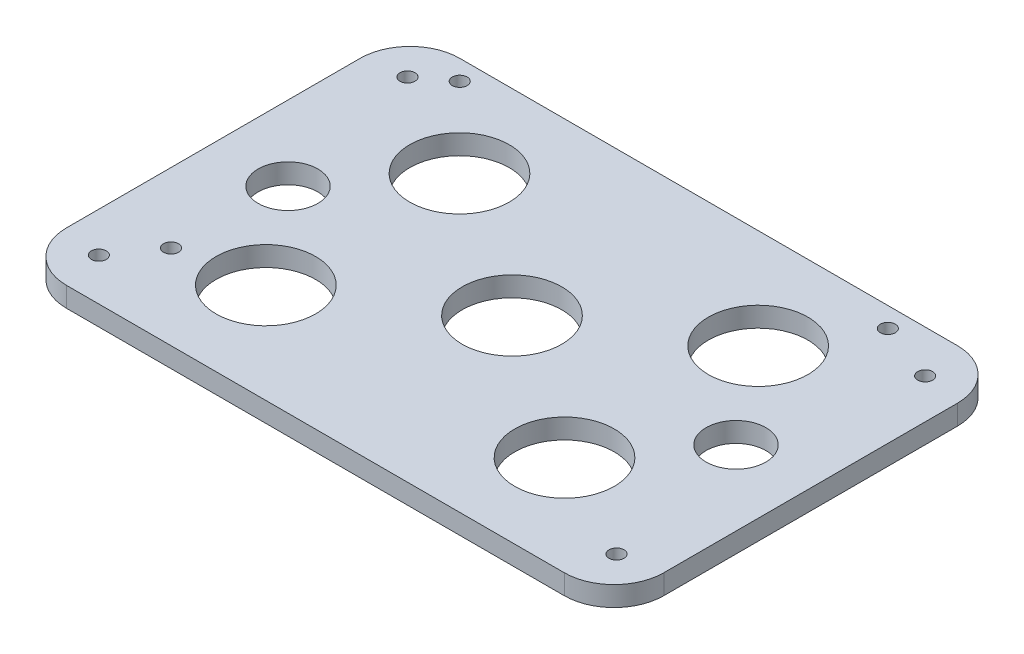
from build123d import *

# Parameters (mm, degrees)
SKETCH1_R           = 1.5
SKETCH1_R_2         = 6
SKETCH1_R_3         = 10
BOSS_EXTRUDE1_DEPTH = 4
CUT_EXTRUDE1_DEPTH  = 25


with BuildPart() as part:
    # Sketch1 → Boss-Extrude1 (new body)
    with BuildSketch(Plane(origin=(0, 0, 0), x_dir=(1, 0, 0), z_dir=(0, 1, 0))):
        with BuildLine():
            Line((-50, -39.5), (50, -39.5))
            ThreePointArc((50, -39.5), (57.071067812, -36.571067812), (60, -29.5))
            Line((60, -29.5), (60, 29.5))
            ThreePointArc((60, 29.5), (57.071067812, 36.571067812), (50, 39.5))
            Line((50, 39.5), (-50, 39.5))
            ThreePointArc((-50, 39.5), (-57.071067812, 36.571067812), (-60, 29.5))
            Line((-60, 29.5), (-60, -29.5))
            ThreePointArc((-60, -29.5), (-57.071067812, -36.571067812), (-50, -39.5))
        make_face()
        with Locations(Location((40, 35.5, 0), (0, 0, 270))):
            Circle(SKETCH1_R, mode=Mode.SUBTRACT)
        with Locations(Location((45, 0, 0), (0, 0, 270))):
            Circle(SKETCH1_R_2, mode=Mode.SUBTRACT)
        with Locations(Location((30, 19.45, 0), (0, 0, 270))):
            Circle(SKETCH1_R_3, mode=Mode.SUBTRACT)
        with Locations(Location((30, -19.45, 0), (0, 0, 270))):
            Circle(SKETCH1_R_3, mode=Mode.SUBTRACT)
        with Locations(Location((0, 0, 0), (0, 0, 270))):
            Circle(SKETCH1_R_3, mode=Mode.SUBTRACT)
        with Locations(Location((-30, -19.45, 0), (0, 0, 270))):
            Circle(SKETCH1_R_3, mode=Mode.SUBTRACT)
        with Locations(Location((-46, 35.5, 0), (0, 0, 270))):
            Circle(SKETCH1_R, mode=Mode.SUBTRACT)
        with Locations(Location((-46, -22.5, 0), (0, 0, 270))):
            Circle(SKETCH1_R, mode=Mode.SUBTRACT)
        with Locations(Location((-45, 0, 0), (0, 0, 270))):
            Circle(SKETCH1_R_2, mode=Mode.SUBTRACT)
        with Locations(Location((-30, 19.45, 0), (0, 0, 270))):
            Circle(SKETCH1_R_3, mode=Mode.SUBTRACT)
    extrude(amount=BOSS_EXTRUDE1_DEPTH)

    # Sketch2 → Cut-Extrude1 (cut)
    with BuildSketch(Plane(origin=(0, 4, 0), x_dir=(1, 0, 0), z_dir=(0, 1, 0))):
        with BuildLine():
            ThreePointArc((-50.5, 31), (-53.060660172, 32.060660172), (-52, 29.5))
            Line((-52, 29.5), (-52, 31))
            Line((-52, 31), (-50.5, 31))
        make_face()
        with BuildLine():
            Line((-52, 31), (-52, 29.5))
            ThreePointArc((-52, 29.5), (-50.939339828, 29.939339828), (-50.5, 31))
            Line((-50.5, 31), (-52, 31))
        make_face()
        with BuildLine():
            ThreePointArc((-52, -29.5), (-53.060660172, -32.060660172), (-50.5, -31))
            Line((-50.5, -31), (-52, -31))
            Line((-52, -31), (-52, -29.5))
        make_face()
        with BuildLine():
            Line((-52, -31), (-50.5, -31))
            ThreePointArc((-50.5, -31), (-50.939339828, -29.939339828), (-52, -29.5))
            Line((-52, -29.5), (-52, -31))
        make_face()
        with BuildLine():
            ThreePointArc((52, -29.5), (50.939339828, -29.939339828), (50.5, -31))
            Line((50.5, -31), (52, -31))
            Line((52, -31), (52, -29.5))
        make_face()
        with BuildLine():
            Line((52, -31), (50.5, -31))
            ThreePointArc((50.5, -31), (52, -32.5), (53.5, -31))
            ThreePointArc((53.5, -31), (53.060660172, -29.939339828), (52, -29.5))
            Line((52, -29.5), (52, -31))
        make_face()
        with BuildLine():
            ThreePointArc((50.5, 31), (50.939339828, 29.939339828), (52, 29.5))
            Line((52, 29.5), (52, 31))
            Line((52, 31), (50.5, 31))
        make_face()
        with BuildLine():
            Line((52, 31), (52, 29.5))
            ThreePointArc((52, 29.5), (53.060660172, 29.939339828), (53.5, 31))
            ThreePointArc((53.5, 31), (52, 32.5), (50.5, 31))
            Line((50.5, 31), (52, 31))
        make_face()
    extrude(amount=-CUT_EXTRUDE1_DEPTH, mode=Mode.SUBTRACT)


solid = part.part
